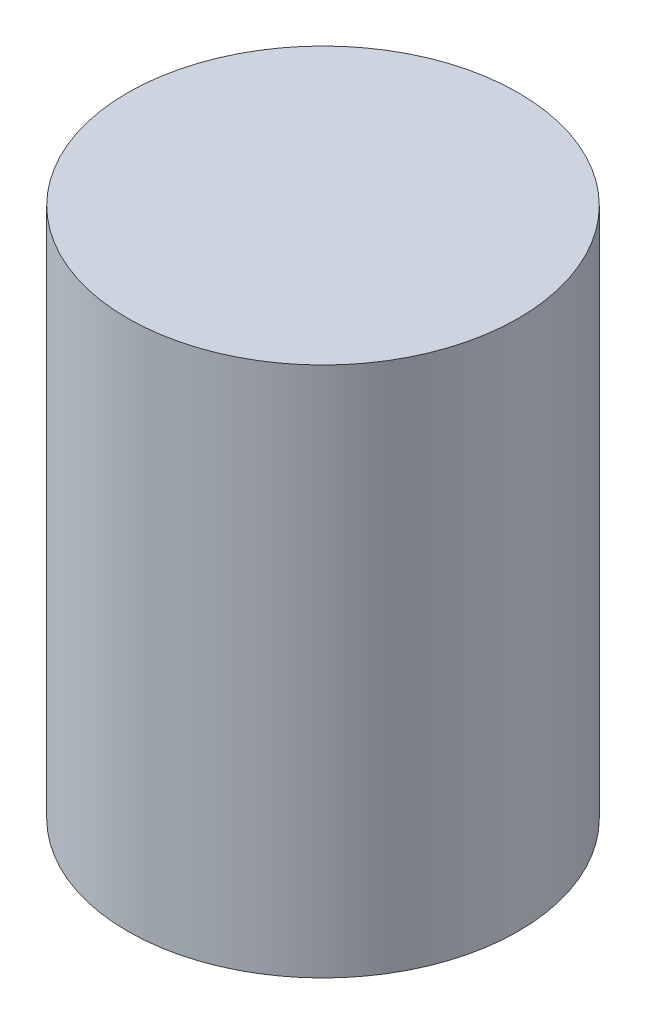
from build123d import *

# Parameters (mm, degrees)
ESQUISSE1_R        = 73.61
BOSS_EXTRU_1_DEPTH = 200


with BuildPart() as part:
    # Esquisse1 → Boss.-Extru.1 (new body)
    with BuildSketch(Plane(origin=(0, 0, 0), x_dir=(1, 0, 0), z_dir=(0, 1, 0))):
        with Locations(Location((0, 0, 0), (0, 0, 270))):
            Circle(ESQUISSE1_R)
    extrude(amount=BOSS_EXTRU_1_DEPTH)


solid = part.part
